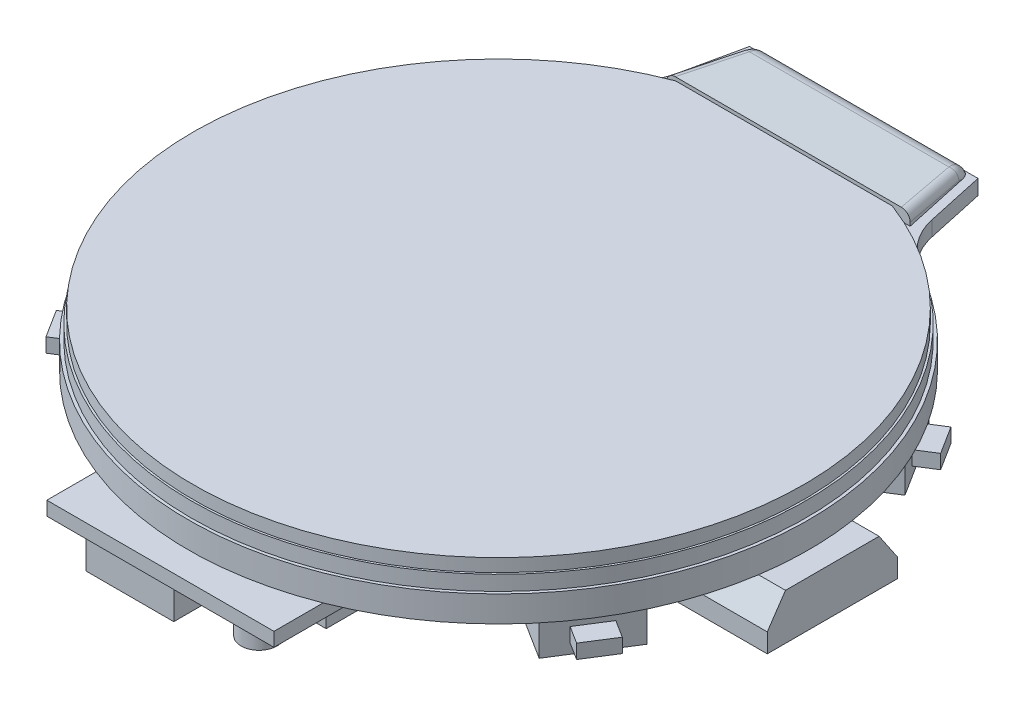
from build123d import *

# Parameters (mm, degrees)
BOSS_EXTRUDE1_DEPTH     = 0.75
BOSS_EXTRUDE2_DEPTH     = 0.86
SKETCH3_R               = 17.905
BOSS_EXTRUDE3_DEPTH     = 1.5
SKETCH4_W               = 13.1
SKETCH4_H               = 19.04
BOSS_EXTRUDE4_DEPTH     = 0.8
SKETCH5_W               = 10.33
SKETCH5_H               = 13.26
BOSS_EXTRUDE5_DEPTH     = 1.96
SKETCH6_W               = 5.07
SKETCH6_H               = 2.08
BOSS_EXTRUDE6_DEPTH     = 1.91
SKETCH7_R               = 1.035
BOSS_EXTRUDE7_DEPTH     = 1.4
BOSS_EXTRUDE8_DEPTH     = 1.95
SKETCH9_W               = 1.91
SKETCH9_H               = 0.82
BOSS_EXTRUDE9_DEPTH     = 1.2
MIRROR2_COPY_1_SKETCH_W = 1.91
MIRROR2_COPY_1_SKETCH_H = 0.82
MIRROR2_COPY_1_DEPTH    = 1.2
SKETCH10_W              = 5.55
SKETCH10_H              = 7.5
BOSS_EXTRUDE10_DEPTH    = 2.65
CUT_EXTRUDE1_DEPTH      = 3.65
BOSS_EXTRUDE11_DEPTH    = 0.7
CUT_EXTRUDE2_DEPTH      = 10
CUT_EXTRUDE2_DEPTH_BACK = 10
FILLET1_R               = 0.5


with BuildPart() as part:
    # Sketch1 → Boss-Extrude1 (new body)
    with BuildSketch(Plane(origin=(0, 0, 0), x_dir=(1, 0, 0), z_dir=(0, 1, 0))):
        with BuildLine():
            Line((-6.25, 16.468932115), (6.25, 16.468932115))
            ThreePointArc((6.25, 16.468932115), (0, -17.615), (-6.25, 16.468932115))
        make_face()
    extrude(amount=BOSS_EXTRUDE1_DEPTH)

    # Sketch2 → Boss-Extrude2 (add)
    with BuildSketch(Plane(origin=(0, 0, 0), x_dir=(1, 0, 0), z_dir=(0, 1, 0))):
        with BuildLine():
            Line((6.59, 21.07), (-6.59, 21.07))
            Line((-6.59, 21.07), (-7.33, 17.670177364))
            ThreePointArc((-7.33, 17.670177364), (-7.956125045, 16.26379425), (-9.09, 15.222509649))
            ThreePointArc((-9.09, 15.222509649), (0, -17.73), (9.09, 15.222509649))
            ThreePointArc((9.09, 15.222509649), (7.956125045, 16.26379425), (7.33, 17.670177364))
            Line((7.33, 17.670177364), (6.59, 21.07))
        make_face()
    extrude(amount=-BOSS_EXTRUDE2_DEPTH)

    # Sketch3 → Boss-Extrude3 (add)
    with BuildSketch(Plane.XZ.offset(0.86)):
        with Locations(Location((0, 0, 0), (0, 0, 297.520154759))):
            Circle(SKETCH3_R)
    extrude(amount=BOSS_EXTRUDE3_DEPTH)

    # Sketch4 → Boss-Extrude4 (add)
    with BuildSketch(Plane.XZ.offset(2.36)):
        with Locations((0, 9.98)):
            Rectangle(SKETCH4_W, SKETCH4_H)
    extrude(amount=BOSS_EXTRUDE4_DEPTH)

    # Sketch5 → Boss-Extrude5 (add)
    with BuildSketch(Plane.XZ.offset(3.16)):
        with Locations((0, 8.475)):
            Rectangle(SKETCH5_W, SKETCH5_H)
    extrude(amount=BOSS_EXTRUDE5_DEPTH)

    # Sketch6 → Boss-Extrude6 (add)
    with BuildSketch(Plane.XZ.offset(3.16)):
        with Locations((-2.065, 18.16)):
            Rectangle(SKETCH6_W, SKETCH6_H)
    extrude(amount=BOSS_EXTRUDE6_DEPTH)

    # Sketch7 → Boss-Extrude7 (add)
    with BuildSketch(Plane.XZ.offset(3.16)):
        with Locations(Location((4.14, 17.95, 0), (0, 0, 270))):
            Circle(SKETCH7_R)
    extrude(amount=BOSS_EXTRUDE7_DEPTH)

    # Sketch8 → Boss-Extrude8 (add)
    with BuildSketch(Plane.XZ.offset(2.36)):
        Polygon((16, -7.445460012), (13.596778104, -11.25), (11.483144777, -9.914876724), (13.886366674, -6.110336737), align=None)
        Polygon((-16, -7.445460012), (-13.596778104, -11.25), (-11.483144777, -9.914876724), (-13.886366674, -6.110336737), align=None)
        Polygon((-16, 7.445460012), (-13.596778104, 11.25), (-11.483144777, 9.914876724), (-13.886366674, 6.110336737), align=None)
        Polygon((13.886366674, 6.110336737), (11.483144777, 9.914876724), (13.596778104, 11.25), (16, 7.445460012), align=None)
    extrude(amount=BOSS_EXTRUDE8_DEPTH)

    # Sketch9 → Boss-Extrude9 (add)
    with BuildSketch(Plane(origin=(-14.798389052, 0, -9.347730006), x_dir=(-0.5340493103180728, 0, 0.84545333055633), z_dir=(-0.8454533305563299, 0, -0.5340493103180727))):
        with Locations((0, -3.335)):
            Rectangle(SKETCH9_W, SKETCH9_H)
    boss_extrude9 = extrude(amount=BOSS_EXTRUDE9_DEPTH)

    # Mirror1: Boss-Extrude9 across plane
    add(boss_extrude9.mirror(Plane.XY))

    # Mirror2: Boss-Extrude9 across plane
    add(boss_extrude9.mirror(Plane(origin=(0, 0, 0), x_dir=(0, 0, 1), z_dir=(1, 0, 0))))

    # Mirror2 copy 1 sketch → Mirror2 copy 1 (add)
    with BuildSketch(Plane(origin=(14.798389052, 0, 9.347730006), x_dir=(0.5340493103180728, 0, -0.84545333055633), z_dir=(0.8454533305563299, 0, 0.5340493103180727))):
        with Locations((0, -3.335)):
            Rectangle(MIRROR2_COPY_1_SKETCH_W, MIRROR2_COPY_1_SKETCH_H)
    extrude(amount=MIRROR2_COPY_1_DEPTH)

    # Sketch10 → Boss-Extrude10 (add)
    with BuildSketch(Plane(origin=(0, -2.36, 0), x_dir=(-1, 0, 0), z_dir=(0, -1, 0))):
        with Locations((-16.48, 0)):
            Rectangle(SKETCH10_W, SKETCH10_H)
    extrude(amount=BOSS_EXTRUDE10_DEPTH)

    # Sketch11 → Cut-Extrude1 (cut)
    with BuildSketch(Plane(origin=(19.255, 0, 0), x_dir=(0, 0, -1), z_dir=(1, 0, 0))):
        Polygon((3.75, -5.01), (3.75, -3.91), (2.7, -2.36), (4.361270296, -2.36), (4.361270296, -9.207681493), (-4.361270296, -9.207681493), (-4.361270296, -2.36), (-2.7, -2.36), (-3.75, -3.91), (-3.75, -5.01), align=None)
    extrude(amount=-CUT_EXTRUDE1_DEPTH, mode=Mode.SUBTRACT)

    # Sketch12 → Boss-Extrude11 (add)
    with BuildSketch(Plane(origin=(0, 0, 0), x_dir=(1, 0, 0), z_dir=(0, 1, 0))):
        Polygon((-7.025339783, 16.718932115), (7.025339783, 16.718932115), (6.078293252, 21.07), (-6.078293252, 21.07), align=None)
    extrude(amount=BOSS_EXTRUDE11_DEPTH)

    # Sketch13 → Cut-Extrude2 (cut, two sides: drawn at the far end of the back side and taken through both)
    with BuildSketch(Plane(origin=(0, 0, 0), x_dir=(0, 0, -1), z_dir=(1, 0, 0)).offset(-CUT_EXTRUDE2_DEPTH_BACK)):
        with BuildLine():
            Line((16.718932115, 0.7), (20.225865386, 0.576368288))
            ThreePointArc((20.225865386, 0.576368288), (20.731401374, 0.410430291), (21.07, 0))
            Line((21.07, 0), (21.650216757, 1.081319804))
            Line((21.650216757, 1.081319804), (16.718932115, 1.620600457))
            Line((16.718932115, 1.620600457), (16.718932115, 0.7))
        make_face()
    extrude(amount=CUT_EXTRUDE2_DEPTH + CUT_EXTRUDE2_DEPTH_BACK, mode=Mode.SUBTRACT)

    # Fillet1
    fillet1_edges = [part.edges().sort_by_distance(p)[0] for p in [
        (6.152517901, 0.412074342, -20.728985619),
        (-6.152517901, 0.412074342, -20.728985619),
        (-6.643683018, 0.638184144, -18.47239875),
        (6.643683018, 0.638184144, -18.47239875),
    ]]
    fillet(fillet1_edges, radius=FILLET1_R)


solid = part.part
